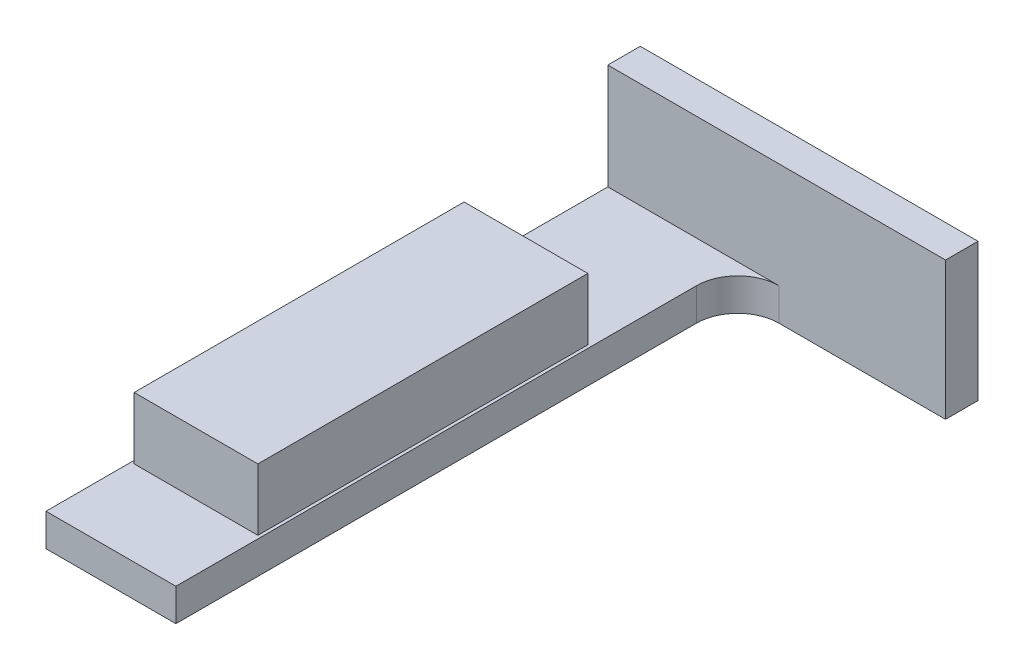
from build123d import *

# Parameters (mm, degrees)
SKETCH1_W      = 52
SKETCH1_H      = 21.25
EXTRUDE1_DEPTH = 5
SKETCH2_W      = 20
SKETCH2_H      = 5
EXTRUDE2_DEPTH = 86.5
FILLET1_R      = 6.35
SKETCH3_W      = 19.05
SKETCH3_H      = 50.8
EXTRUDE3_DEPTH = 9.525


with BuildPart() as part:
    # Sketch1 → Extrude1 (new body)
    with BuildSketch(Plane.XY):
        with Locations((26, -10.625)):
            Rectangle(SKETCH1_W, SKETCH1_H)
    extrude(amount=EXTRUDE1_DEPTH)

    # Sketch2 → Extrude2 (add)
    with BuildSketch(Plane.XY.offset(5)):
        with Locations((10, -18.75)):
            Rectangle(SKETCH2_W, SKETCH2_H)
    extrude(amount=EXTRUDE2_DEPTH)

    # Fillet1
    fillet1_edges = [part.edges().sort_by_distance(p)[0] for p in [
        (20, -18.75, 5),
    ]]
    fillet(fillet1_edges, radius=FILLET1_R)

    # Sketch3 → Extrude3 (add)
    with BuildSketch(Plane(origin=(0, -16.25, 0), x_dir=(1, 0, 0), z_dir=(0, 1, 0))):
        with Locations((10, -53)):
            Rectangle(SKETCH3_W, SKETCH3_H)
    extrude(amount=EXTRUDE3_DEPTH)


solid = part.part
